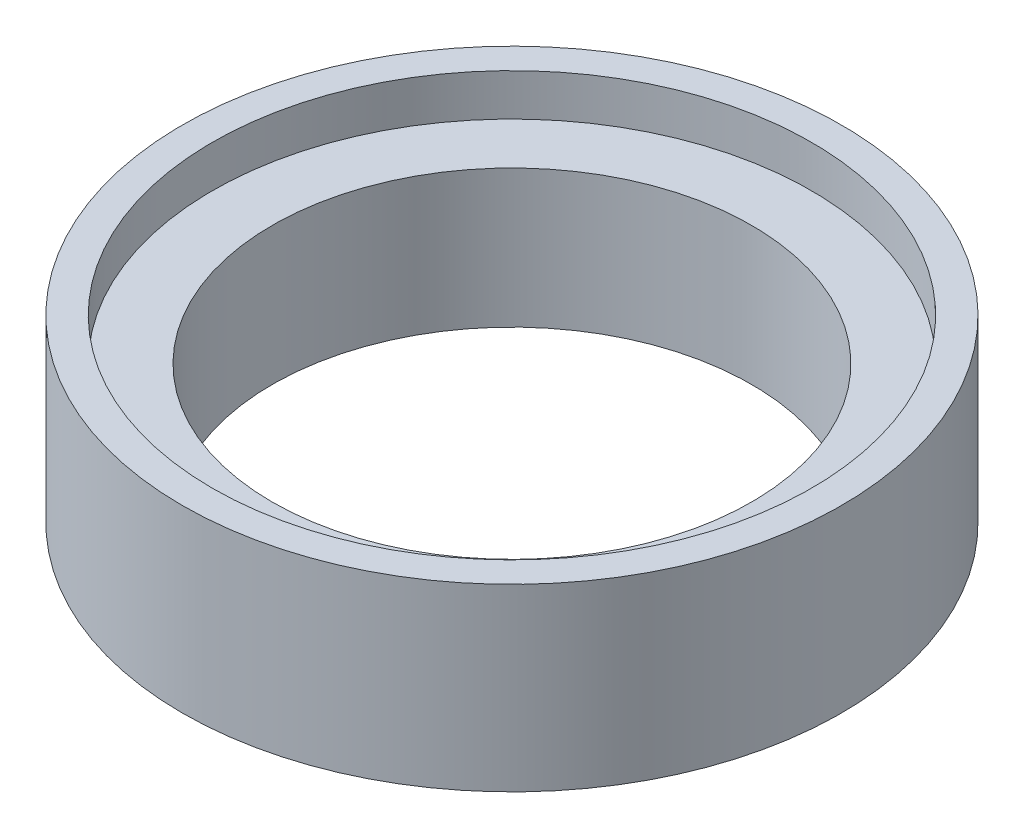
from build123d import *

# Parameters (mm, degrees)
SKETCH_1_R      = 5.5
SKETCH_1_R_2    = 5
EXTRUDE_1_DEPTH = 3
SKETCH_1_3_R    = 5
SKETCH_1_3_R_2  = 4
EXTRUDE_2_DEPTH = 2.3


with BuildPart() as part:
    # 草图1 → 凸台-拉伸1 (new body)
    with BuildSketch(Plane(origin=(0, 0, 0), x_dir=(1, 0, 0), z_dir=(0, 1, 0))):
        Circle(SKETCH_1_R)
        Circle(SKETCH_1_R_2, mode=Mode.SUBTRACT)
    extrude(amount=EXTRUDE_1_DEPTH)

    # 草图1<3> → 凸台-拉伸2 (add)
    with BuildSketch(Plane(origin=(0, 0, 0), x_dir=(1, 0, 0), z_dir=(0, 1, 0))):
        Circle(SKETCH_1_3_R)
        Circle(SKETCH_1_3_R_2, mode=Mode.SUBTRACT)
    extrude(amount=EXTRUDE_2_DEPTH)


solid = part.part
